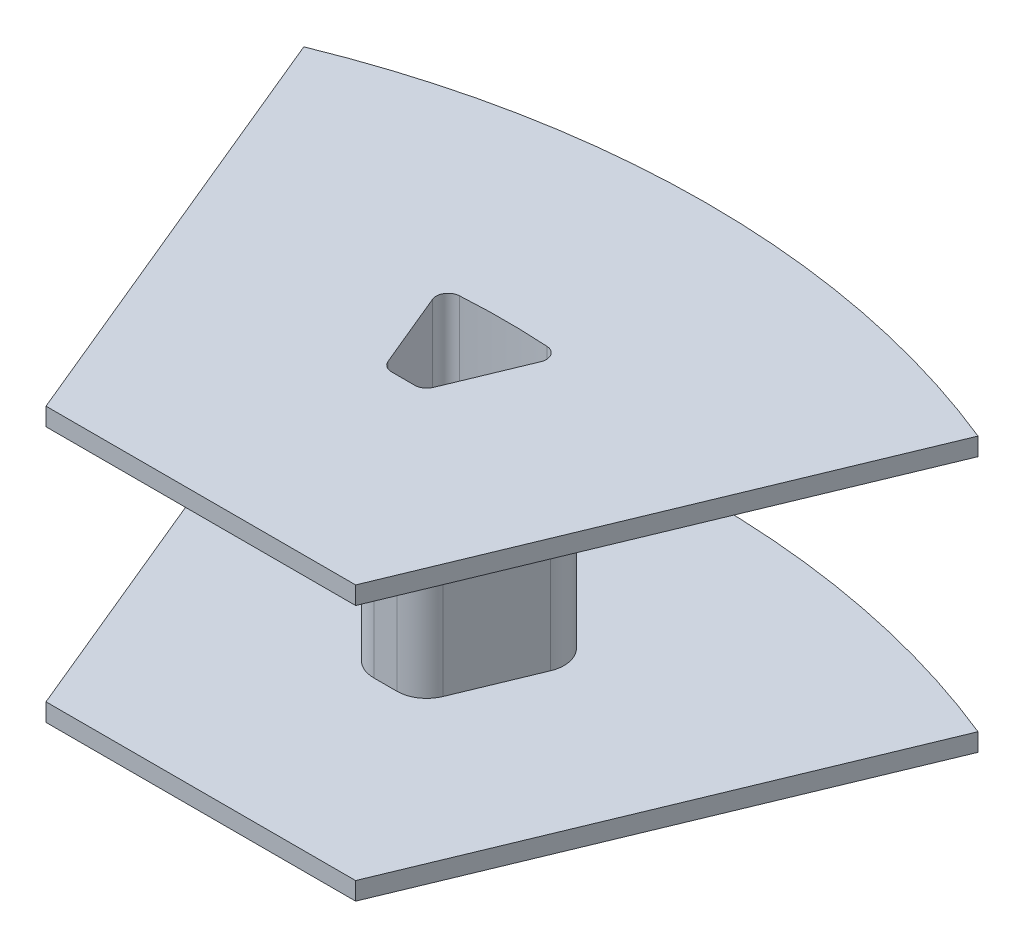
from build123d import *

# Parameters (mm, degrees)
BOSS_EXTRUDE1_DEPTH = 0.75
BOSS_EXTRUDE2_DEPTH = 20


with BuildPart() as part:
    # Sketch1 → Boss-Extrude1 (new, symmetric)
    with BuildSketch(Plane(origin=(0, 0, 0), x_dir=(1, 0, 0), z_dir=(0, 1, 0))):
        with BuildLine():
            Line((-28.307864731, 69.452608262), (-13, 32.496153619))
            Line((-13, 32.496153619), (13, 32.496153619))
            Line((13, 32.496153619), (28.307864731, 69.452608262))
            ThreePointArc((28.307864731, 69.452608262), (0, 75), (-28.307864731, 69.452608262))
        make_face()
        with BuildLine():
            Line((-4.543006128, 56.502305121), (-1.89666405, 50.113470186))
            ThreePointArc((-1.89666405, 50.113470186), (-1.52835475, 49.664684006), (-0.972784517, 49.496153619))
            Line((-0.972784517, 49.496153619), (0.972784517, 49.496153619))
            ThreePointArc((0.972784517, 49.496153619), (1.52835475, 49.664684006), (1.89666405, 50.113470186))
            Line((1.89666405, 50.113470186), (4.543006128, 56.502305121))
            ThreePointArc((4.543006128, 56.502305121), (4.467823117, 57.413868704), (3.682620044, 57.882970808))
            ThreePointArc((3.682620044, 57.882970808), (0, 58), (-3.682620044, 57.882970808))
            ThreePointArc((-3.682620044, 57.882970808), (-4.467823117, 57.413868704), (-4.543006128, 56.502305121))
        make_face(mode=Mode.SUBTRACT)
    boss_extrude1 = extrude(amount=BOSS_EXTRUDE1_DEPTH, both=True)

    # Sketch2 → Boss-Extrude2 (add)
    with BuildSketch(Plane.XZ.offset(0.75)):
        with BuildLine():
            Line((-0.972784517, -47.996153619), (0.972784517, -47.996153619))
            ThreePointArc((0.972784517, -47.996153619), (2.3617101, -48.417479588), (3.282483349, -49.539445038))
            Line((3.282483349, -49.539445038), (5.928825426, -55.928279972))
            ThreePointArc((5.928825426, -55.928279972), (5.7408679, -58.207188929), (3.777860218, -59.379944191))
            ThreePointArc((3.777860218, -59.379944191), (0, -59.5), (-3.777860218, -59.379944191))
            ThreePointArc((-3.777860218, -59.379944191), (-5.7408679, -58.207188929), (-5.928825426, -55.928279972))
            Line((-5.928825426, -55.928279972), (-3.282483349, -49.539445038))
            ThreePointArc((-3.282483349, -49.539445038), (-2.3617101, -48.417479588), (-0.972784517, -47.996153619))
        make_face()
        with BuildLine():
            Line((1.89666405, -50.113470186), (4.543006128, -56.502305121))
            ThreePointArc((4.543006128, -56.502305121), (4.467823117, -57.413868704), (3.682620044, -57.882970808))
            ThreePointArc((3.682620044, -57.882970808), (0, -58), (-3.682620044, -57.882970808))
            ThreePointArc((-3.682620044, -57.882970808), (-4.467823117, -57.413868704), (-4.543006128, -56.502305121))
            Line((-4.543006128, -56.502305121), (-1.89666405, -50.113470186))
            ThreePointArc((-1.89666405, -50.113470186), (-1.52835475, -49.664684006), (-0.972784517, -49.496153619))
            Line((-0.972784517, -49.496153619), (0.972784517, -49.496153619))
            ThreePointArc((0.972784517, -49.496153619), (1.52835475, -49.664684006), (1.89666405, -50.113470186))
        make_face(mode=Mode.SUBTRACT)
    extrude(amount=BOSS_EXTRUDE2_DEPTH)

    # Mirror1: Boss-Extrude1 across plane
    add(boss_extrude1.mirror(Plane(origin=(0, -10.75, 0), x_dir=(0, 0, 1), z_dir=(0, -1, 0))))


solid = part.part
